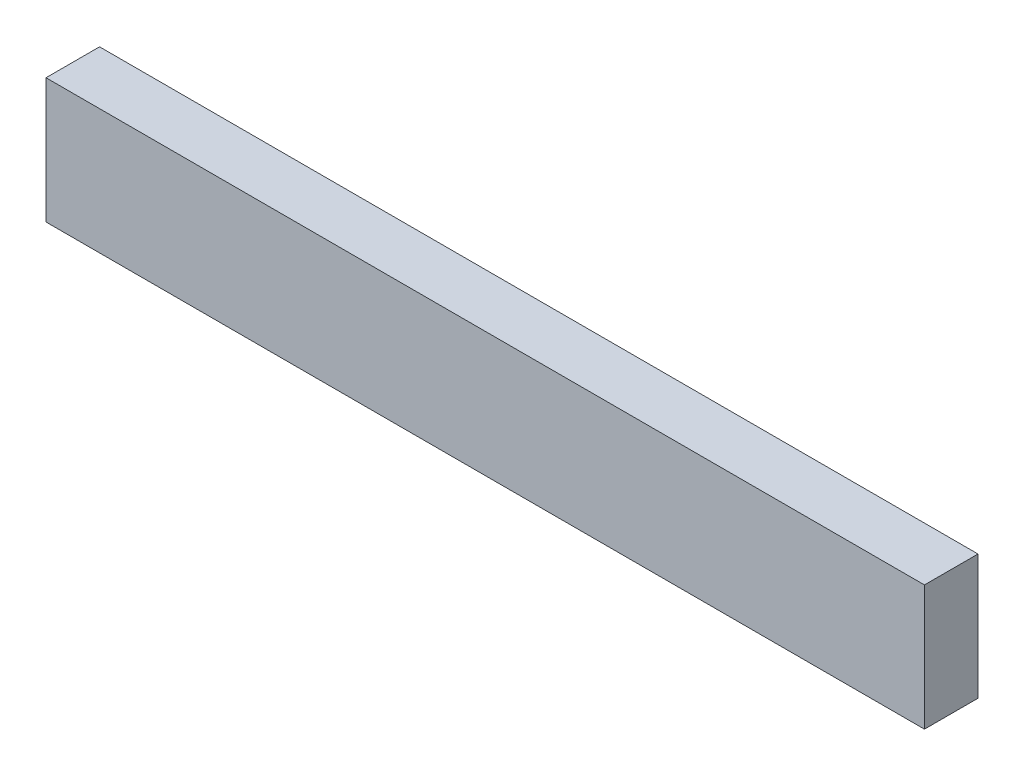
from build123d import *

# Parameters (mm, degrees)
SKETCH1_W           = 625
SKETCH1_H           = 88.9
BOSS_EXTRUDE1_DEPTH = 38.1


with BuildPart() as part:
    # Sketch1 → Boss-Extrude1 (new body)
    with BuildSketch(Plane.XY):
        with Locations((312.5, 44.45)):
            Rectangle(SKETCH1_W, SKETCH1_H)
    extrude(amount=BOSS_EXTRUDE1_DEPTH)


solid = part.part
